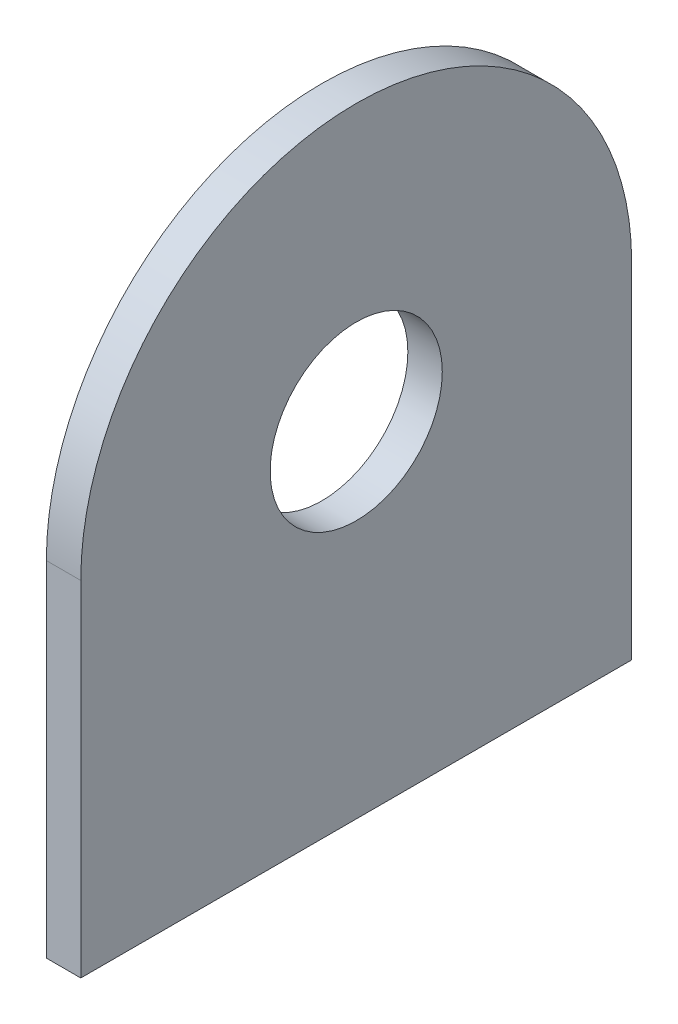
from build123d import *

# Parameters (mm, degrees)
SKETCH1_R           = 7.9375
BOSS_EXTRUDE3_DEPTH = 3.175


with BuildPart() as part:
    # Sketch1 → Boss-Extrude3 (new body)
    with BuildSketch(Plane(origin=(0, 0, 0), x_dir=(0, 0, -1), z_dir=(1, 0, 0))):
        with BuildLine():
            Line((-25.4, 0), (-25.4, -31.75))
            Line((-25.4, -31.75), (25.4, -31.75))
            Line((25.4, -31.75), (25.4, 0))
            ThreePointArc((25.4, 0), (0, 25.4), (-25.4, 0))
        make_face()
        Circle(SKETCH1_R, mode=Mode.SUBTRACT)
    extrude(amount=BOSS_EXTRUDE3_DEPTH)


solid = part.part
